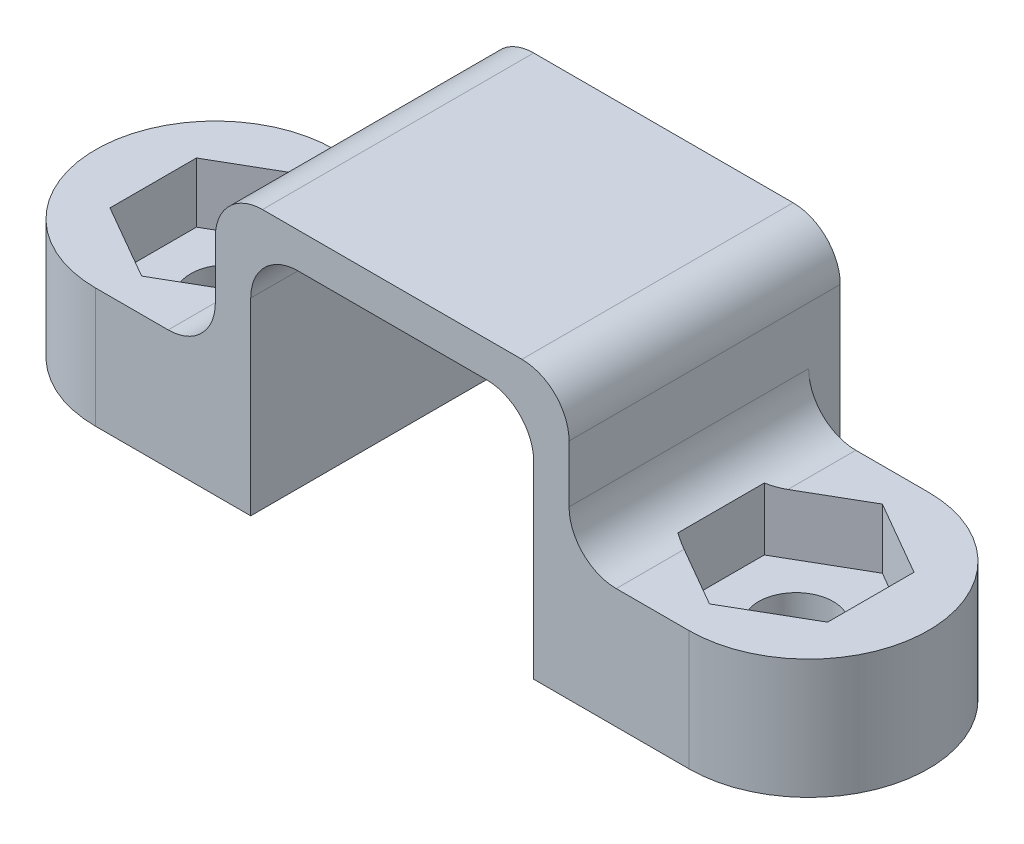
from build123d import *

# Parameters (mm, degrees)
BOSS_EXTRUDE1_DEPTH     = 11.5
FILLET1_R               = 2
BOSS_EXTRUDE2_DEPTH     = 5.08
FILLET2_R               = 2
FILLET3_R               = 2
SKETCH3_R               = 1.5875
CUT_EXTRUDE1_DEPTH      = 30.958731615
CUT_EXTRUDE3_DEPTH      = 2
CUT_EXTRUDE3_DEPTH_BACK = 2.54
CUT_EXTRUDE3_START      = 5.08


with BuildPart() as part:
    # Sketch1 → Boss-Extrude1 (new body)
    with BuildSketch(Plane.XY):
        Polygon((1.5, -11.5), (1.5, -1.5), (13.5, -1.5), (13.5, -11.5), (15, -11.5), (15, 0), (0, 0), (0, -11.5), align=None)
    extrude(amount=BOSS_EXTRUDE1_DEPTH)

    # Fillet1
    fillet1_edges = [part.edges().sort_by_distance(p)[0] for p in [
        (13.5, -1.5, 5.75),
        (1.5, -1.5, 5.75),
    ]]
    fillet(fillet1_edges, radius=FILLET1_R)

    # Sketch2 → Boss-Extrude2 (add)
    with BuildSketch(Plane(origin=(0, -11.5, 0), x_dir=(1, 0, 0), z_dir=(0, 1, 0))):
        with BuildLine():
            Line((15, -1.34), (15, -11.5))
            Line((15, -11.5), (20.08, -11.5))
            ThreePointArc((20.08, -11.5), (25.16, -6.42), (20.08, -1.34))
            Line((20.08, -1.34), (15, -1.34))
        make_face()
        with BuildLine():
            Line((0, -1.34), (-5.08, -1.34))
            ThreePointArc((-5.08, -1.34), (-10.16, -6.42), (-5.08, -11.5))
            Line((-5.08, -11.5), (0, -11.5))
            Line((0, -11.5), (0, -1.34))
        make_face()
    extrude(amount=BOSS_EXTRUDE2_DEPTH)

    # Fillet2
    fillet2_edges = [part.edges().sort_by_distance(p)[0] for p in [
        (15, -6.42, 6.42),
        (0, -6.42, 6.42),
    ]]
    fillet(fillet2_edges, radius=FILLET2_R)

    # Fillet3
    fillet3_edges = [part.edges().sort_by_distance(p)[0] for p in [
        (15, 0, 5.75),
        (0, 0, 5.75),
    ]]
    fillet(fillet3_edges, radius=FILLET3_R)

    # Sketch3 → Cut-Extrude1 (cut, through all)
    with BuildSketch(Plane(origin=(0, -11.5, 0), x_dir=(1, 0, 0), z_dir=(0, 1, 0))):
        with Locations(Location((19.54, -6.42, 0), (0, 0, 270))):
            Circle(SKETCH3_R)
        with Locations(Location((-4.54, -6.42, 0), (0, 0, 90))):
            Circle(SKETCH3_R)
    extrude(amount=CUT_EXTRUDE1_DEPTH, mode=Mode.SUBTRACT)

    # Sketch6 → Cut-Extrude3 (cut, two sides: drawn at the far end of the back side and taken through both)
    with BuildSketch(Plane(origin=(0, -11.5, 0), x_dir=(1, 0, 0), z_dir=(0, 1, 0)).offset(CUT_EXTRUDE3_START - CUT_EXTRUDE3_DEPTH_BACK)):
        Polygon((-1.365, -4.586912895), (-4.54, -2.753825791), (-7.715, -4.586912895), (-7.715, -8.253087105), (-4.54, -10.086174209), (-1.365, -8.253087105), align=None)
        Polygon((22.715, -8.253087105), (22.715, -4.586912895), (19.54, -2.753825791), (16.365, -4.586912895), (16.365, -8.253087105), (19.54, -10.086174209), align=None)
    extrude(amount=CUT_EXTRUDE3_DEPTH + CUT_EXTRUDE3_DEPTH_BACK, mode=Mode.SUBTRACT)


solid = part.part
